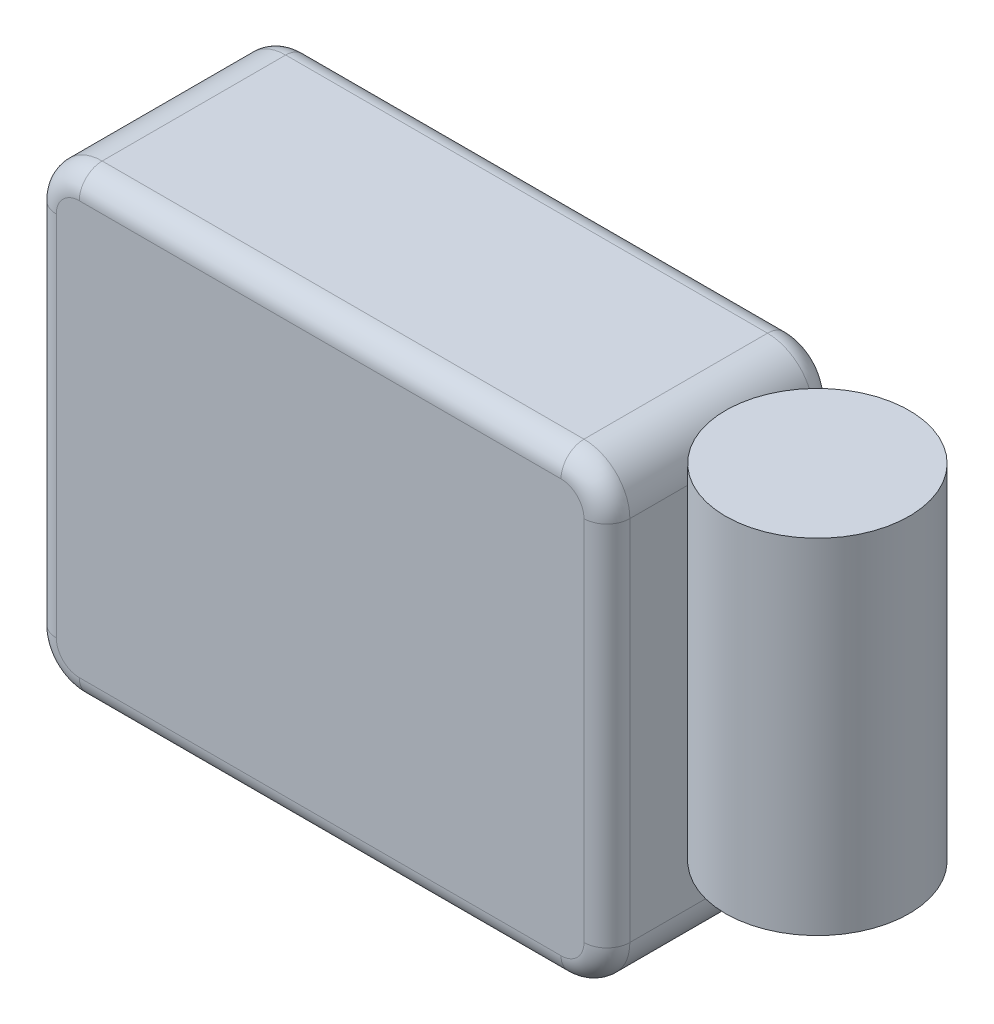
from build123d import *

# Parameters (mm, degrees)
SKETCH1_W           = 25
SKETCH1_H           = 20
BOSS_EXTRUDE1_DEPTH = 10
SKETCH2_R           = 4
BOSS_EXTRUDE2_DEPTH = 15
FILLET1_R           = 2
FILLET2_R           = 1


with BuildPart() as part:
    # Sketch1 → Boss-Extrude1 (new body)
    with BuildSketch(Plane.XY):
        with Locations((138.648869639, 13.05710113)):
            Rectangle(SKETCH1_W, SKETCH1_H)
    extrude(amount=BOSS_EXTRUDE1_DEPTH)

    # Fillet1
    fillet1_edges = [part.edges().sort_by_distance(p)[0] for p in [
        (126.148869639, 23.05710113, 5),
        (151.148869639, 23.05710113, 5),
        (151.148869639, 3.05710113, 5),
        (126.148869639, 3.05710113, 5),
    ]]
    fillet(fillet1_edges, radius=FILLET1_R)

    # Fillet2
    fillet2_edges = [part.edges().sort_by_distance(p)[0] for p in [
        (126.148869639, 13.05710113, 0),
        (126.148869639, 13.05710113, 10),
        (138.648869639, 23.05710113, 0),
        (151.148869639, 13.05710113, 0),
        (138.648869639, 3.05710113, 0),
        (126.734656077, 3.642887568, 0),
        (150.563083201, 3.642887568, 0),
        (150.563083201, 22.471314692, 0),
        (126.734656077, 22.471314692, 0),
        (138.648869639, 23.05710113, 10),
        (138.648869639, 3.05710113, 10),
        (151.148869639, 13.05710113, 10),
        (126.734656077, 3.642887568, 10),
        (150.563083201, 3.642887568, 10),
        (150.563083201, 22.471314692, 10),
        (126.734656077, 22.471314692, 10),
    ]]
    fillet(fillet2_edges, radius=FILLET2_R)


with BuildPart() as body_2:
    # Sketch2 → Boss-Extrude2 (new body)
    with BuildSketch(Plane(origin=(0, 23.05710113, 0), x_dir=(1, 0, 0), z_dir=(0, 1, 0))):
        with Locations(Location((155.148869639, -4.82615975, 0), (0, 0, 270))):
            Circle(SKETCH2_R)
    extrude(amount=-BOSS_EXTRUDE2_DEPTH)


solid = Compound([part.part, body_2.part])
